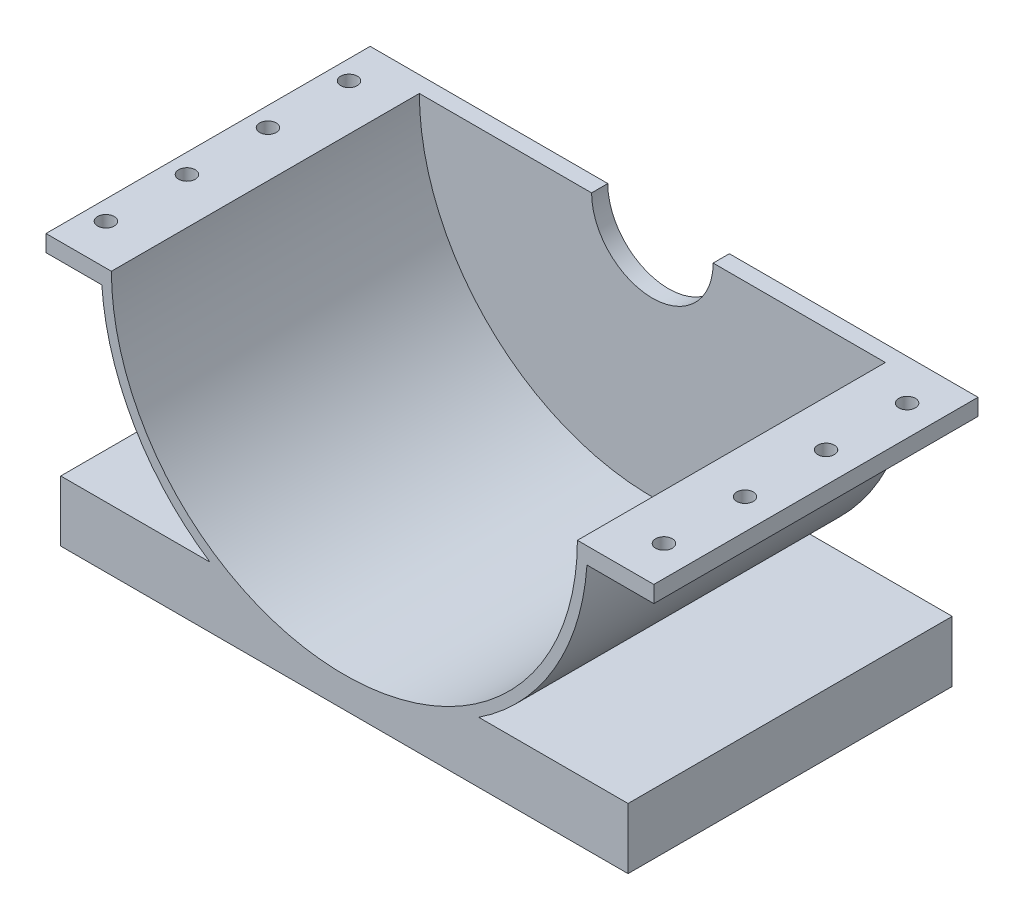
from build123d import *

# Parameters (mm, degrees)
BOSS_EXTRUDE1_DEPTH = 101.6
CUT_EXTRUDE1_DEPTH  = 193.04
CUT_EXTRUDE2_DEPTH  = 320.596404315
SKETCH5_R           = 5.207
CUT_EXTRUDE4_DEPTH  = 82.042


with BuildPart() as part:
    # Sketch2 → Boss-Extrude1 (new, symmetric)
    with BuildSketch(Plane.XY):
        with BuildLine():
            Line((-187.042762313, 0), (193.957237687, 0))
            Line((193.957237687, 0), (193.957237687, -10.414))
            Line((193.957237687, -10.414), (152.043772, -10.414))
            ThreePointArc((152.043772, -10.414), (131.741592603, -76.615356022), (84.242269675, -127))
            Line((84.242269675, -127), (177.8, -127))
            Line((177.8, -127), (177.8, -165.1))
            Line((177.8, -165.1), (-177.8, -165.1))
            Line((-177.8, -165.1), (-177.8, -127))
            Line((-177.8, -127), (-84.242269675, -127))
            ThreePointArc((-84.242269675, -127), (-131.741592603, -76.615356022), (-152.043772, -10.414))
            Line((-152.043772, -10.414), (-187.042762313, -10.414))
            Line((-187.042762313, -10.414), (-187.042762313, 0))
        make_face()
    extrude(amount=BOSS_EXTRUDE1_DEPTH, both=True)

    # Sketch3 → Cut-Extrude1 (cut)
    with BuildSketch(Plane.XY.offset(101.6)):
        with BuildLine():
            Line((-146.05, 0), (146.05, 0))
            ThreePointArc((146.05, 0), (0, -146.05), (-146.05, 0))
        make_face()
    extrude(amount=-CUT_EXTRUDE1_DEPTH, mode=Mode.SUBTRACT)

    # Sketch4 → Cut-Extrude2 (cut, through all)
    with BuildSketch(Plane.XY.offset(-91.44)):
        with BuildLine():
            Line((-38.1, 0), (38.1, 0))
            ThreePointArc((38.1, 0), (0, -38.1), (-38.1, 0))
        make_face()
    extrude(amount=-CUT_EXTRUDE2_DEPTH, mode=Mode.SUBTRACT)

    # Sketch5 → Cut-Extrude4 (cut)
    with BuildSketch(Plane(origin=(0, 0, 0), x_dir=(1, 0, 0), z_dir=(0, 1, 0))):
        with Locations(Location((174.907237687, -76.2, 0), (0, 0, 270))):
            Circle(SKETCH5_R)
        with Locations(Location((174.907237687, -25.4, 0), (0, 0, 270))):
            Circle(SKETCH5_R)
        with Locations(Location((174.907237687, 25.4, 0), (0, 0, 270))):
            Circle(SKETCH5_R)
        with Locations(Location((174.907237687, 76.2, 0), (0, 0, 270))):
            Circle(SKETCH5_R)
    cut_extrude4 = extrude(amount=-CUT_EXTRUDE4_DEPTH, mode=Mode.SUBTRACT)

    # Mirror1: Cut-Extrude4 across plane
    add(cut_extrude4.mirror(Plane(origin=(0, 0, 0), x_dir=(0, 0, 1), z_dir=(1, 0, 0))), mode=Mode.SUBTRACT)


solid = part.part
